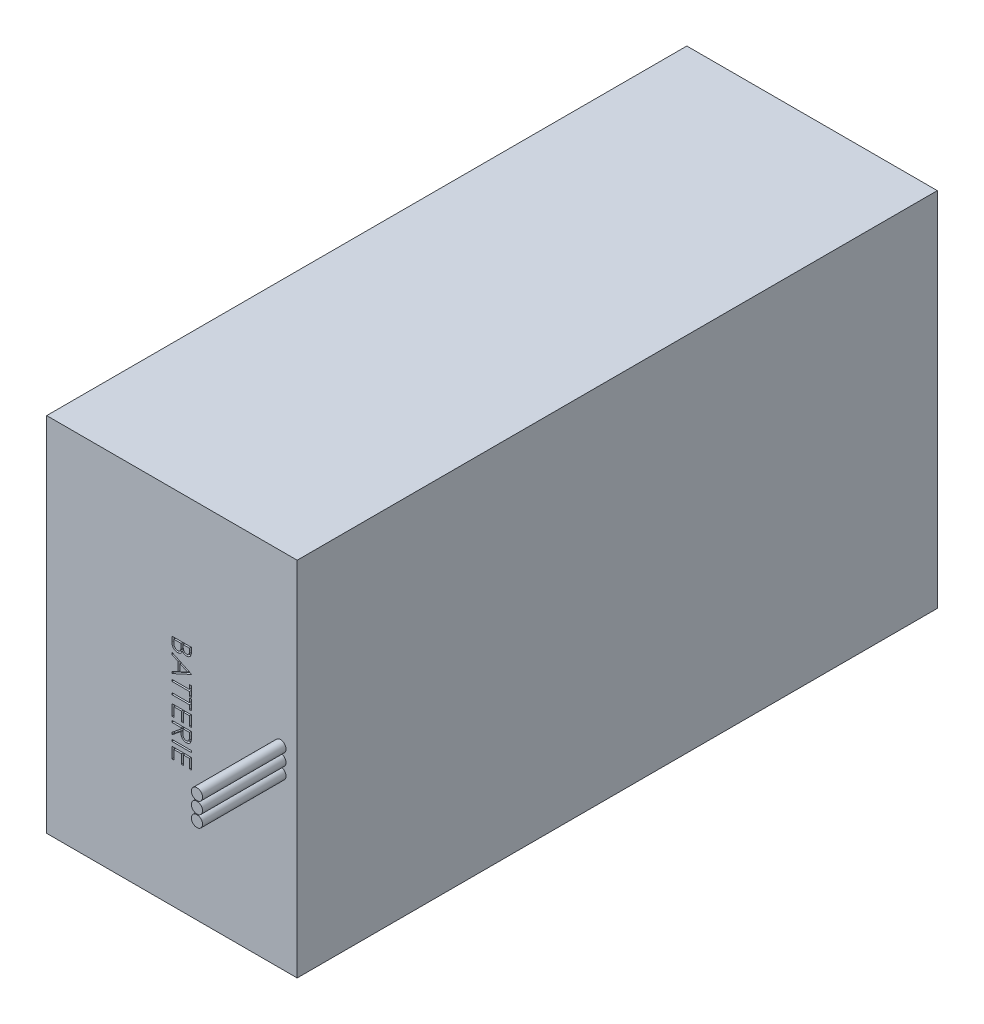
from build123d import *

# Parameters (mm, degrees)
ESQUISSE1_W             = 45
ESQUISSE1_H             = 65
BOSS_EXTRU_1_DEPTH      = 115
ESQUISSE2_R             = 1
BOSS_EXTRU_2_DEPTH      = 15
ESQUISSE4_W             = 3.5
ESQUISSE4_H             = 0.314102564
ENL_V_MAT_EXTRU_2_DEPTH = 0.5


with BuildPart() as part:
    # Esquisse1 → Boss.-Extru.1 (new body)
    with BuildSketch(Plane.XY):
        with Locations((22.5, 32.5)):
            Rectangle(ESQUISSE1_W, ESQUISSE1_H)
    extrude(amount=BOSS_EXTRU_1_DEPTH)

    # Esquisse2 → Boss.-Extru.2 (add)
    with BuildSketch(Plane.XY.offset(115)):
        with Locations(Location((42, 34.6, 0), (0, 0, 180))):
            Circle(ESQUISSE2_R)
        with Locations(Location((42, 32.5, 0), (0, 0, 180))):
            Circle(ESQUISSE2_R)
        with Locations(Location((42, 30.4, 0), (0, 0, 180))):
            Circle(ESQUISSE2_R)
    extrude(amount=BOSS_EXTRU_2_DEPTH)

    # Esquisse4 → Enlèv. mat.-Extru.2 (cut)
    # profile 1 of 8: a face of its own
    with BuildSketch(Plane.XY.offset(115)):
        with BuildLine():
            Line((26, 41.945512821), (26, 41.262620192))
            add(Edge.make_bspline(
                [(26, 41.262620192), (25.99982425, 41.229191714), (25.999483602, 41.164399004), (25.99420047, 41.070179562), (25.986996801, 40.981930751), (25.975566708, 40.899626979), (25.961774931, 40.823306277), (25.945073115, 40.752738639), (25.925046501, 40.688148467), (25.89320022, 40.611035731), (25.845877051, 40.52311507), (25.775948486, 40.427916677), (25.690416023, 40.346512438), (25.593933368, 40.27632612), (25.487797596, 40.220525001), (25.374538407, 40.180155704), (25.255616665, 40.154597828), (25.173973487, 40.151969394), (25.13271234, 40.150641026)],
                knots=[0, 0, 0, 0, 1.001505555, 1.941167018, 2.826882275, 3.653841531, 4.429895133, 5.150066043, 5.825578002, 6.45369114, 7.647487171, 8.808567382, 9.977351308, 11.170798116, 12.373658725, 13.556498008, 14.765093433, 16, 16, 16, 16], degree=3))
            add(Edge.make_bspline(
                [(25.13271234, 40.150641026), (25.094053235, 40.151713115), (25.018084448, 40.153819873), (24.907150679, 40.174651525), (24.801116128, 40.205666884), (24.701287981, 40.250692021), (24.608949247, 40.30860828), (24.52464869, 40.378303814), (24.450429264, 40.461285457), (24.409109541, 40.523557119), (24.388120994, 40.555188301)],
                knots=[0, 0, 0, 0, 1.044266239, 2.052081639, 3.041743201, 4.026043445, 5.00270663, 5.980942822, 6.97441044, 8, 8, 8, 8], degree=3))
            add(Edge.make_bspline(
                [(24.388120994, 40.555188301), (24.372867775, 40.515421215), (24.343684588, 40.439336927), (24.291808319, 40.334559612), (24.236021049, 40.24392491), (24.174776106, 40.167333057), (24.107935032, 40.102816274), (24.036836284, 40.044878864), (23.95797957, 39.996340304), (23.87361028, 39.95464159), (23.784320561, 39.921825139), (23.690518767, 39.898605346), (23.593253774, 39.884337914), (23.526957798, 39.882392407), (23.493489583, 39.881410256)],
                knots=[0, 0, 0, 0, 1.272302504, 2.434229863, 3.488457646, 4.447234501, 5.35599188, 6.26022912, 7.18267843, 8.11661068, 9.06895546, 10.019249207, 11.000057067, 12, 12, 12, 12], degree=3))
            add(Edge.make_bspline(
                [(23.493489583, 39.881410256), (23.459322905, 39.882387409), (23.392099008, 39.884309984), (23.293341106, 39.898485577), (23.198976329, 39.922510777), (23.10833373, 39.955522714), (23.021926377, 39.998852247), (22.938672091, 40.05044643), (22.86078871, 40.113243089), (22.786424081, 40.183238855), (22.719600708, 40.26251659), (22.660109352, 40.34803865), (22.610959363, 40.441035124), (22.570188246, 40.540063883), (22.538590839, 40.645782977), (22.516654453, 40.757800424), (22.501839273, 40.876140566), (22.500623494, 40.957350902), (22.5, 40.998998397)],
                knots=[0, 0, 0, 0, 0.978404568, 1.925038397, 2.85041836, 3.763147166, 4.682162379, 5.614488577, 6.562659439, 7.54271123, 8.535210642, 9.526693784, 10.520907202, 11.541451354, 12.589717429, 13.675358278, 14.807842563, 16, 16, 16, 16], degree=3))
            Line((22.5, 40.998998397), (22.5, 41.945512821))
            Line((22.5, 41.945512821), (26, 41.945512821))
        make_face()
        with BuildLine():
            Line((25.641025641, 41.631410256), (24.519230769, 41.631410256))
            Line((24.519230769, 41.631410256), (24.519230769, 41.420372596))
            add(Edge.make_bspline(
                [(24.519230769, 41.420372596), (24.519627364, 41.389523523), (24.520393667, 41.329916827), (24.522657945, 41.243367536), (24.528720383, 41.163230217), (24.535132411, 41.089228732), (24.545005621, 41.021859071), (24.557087658, 40.960895698), (24.569753809, 40.905790971), (24.591355012, 40.842272003), (24.622955643, 40.770242335), (24.673150423, 40.693944021), (24.731312009, 40.625588757), (24.799660574, 40.568512973), (24.874282065, 40.521415475), (24.955183134, 40.489984648), (25.039205431, 40.467691176), (25.097038901, 40.465736183), (25.126402244, 40.46474359)],
                knots=[0, 0, 0, 0, 1.156481963, 2.23455883, 3.244418989, 4.168404366, 5.01828131, 5.794834307, 6.498111525, 7.13526334, 8.307595709, 9.435046769, 10.546766856, 11.659452936, 12.760769924, 13.837671619, 14.902137667, 16, 16, 16, 16], degree=3))
            add(Edge.make_bspline(
                [(25.126402244, 40.46474359), (25.145837164, 40.465240027), (25.183960884, 40.466213844), (25.239322416, 40.475076735), (25.292056229, 40.487936875), (25.34094948, 40.508028337), (25.387391857, 40.532323067), (25.429320542, 40.563926103), (25.469032638, 40.599616645), (25.505070015, 40.641531714), (25.537359647, 40.689468352), (25.56577169, 40.743883309), (25.588183923, 40.805426328), (25.608288888, 40.872701989), (25.622239543, 40.94678698), (25.633904149, 41.02695739), (25.63983359, 41.113893328), (25.640619428, 41.174038255), (25.641025641, 41.205128205)],
                knots=[0, 0, 0, 0, 0.911752476, 1.788502045, 2.626783689, 3.45400582, 4.26402138, 5.080402872, 5.911472738, 6.767166405, 7.66795952, 8.620018292, 9.640966946, 10.73819047, 11.913090943, 13.176185384, 14.540321519, 16, 16, 16, 16], degree=3))
            Line((25.641025641, 41.205128205), (25.641025641, 41.631410256))
        make_face(mode=Mode.SUBTRACT)
        with BuildLine():
            Line((24.16025641, 41.631410256), (22.858974359, 41.631410256))
            Line((22.858974359, 41.631410256), (22.858974359, 41.184094551))
            add(Edge.make_bspline(
                [(22.858974359, 41.184094551), (22.859356766, 41.152075467), (22.860093805, 41.090362902), (22.862526199, 41.001263785), (22.867942779, 40.918905417), (22.876773248, 40.843240406), (22.885948875, 40.773602695), (22.898648387, 40.710684134), (22.913086196, 40.654388267), (22.93542939, 40.589120076), (22.970080688, 40.51557671), (23.022667742, 40.43637791), (23.084492161, 40.365260638), (23.156948104, 40.30556125), (23.235135085, 40.256263837), (23.31864416, 40.221688685), (23.404927716, 40.199457357), (23.463909533, 40.196830313), (23.493489583, 40.195512821)],
                knots=[0, 0, 0, 0, 1.159821618, 2.235403267, 3.228114831, 4.14795534, 4.994323282, 5.771256229, 6.471395042, 7.097801288, 8.267864287, 9.404187171, 10.531774336, 11.667624178, 12.792825787, 13.866573821, 14.930062559, 16, 16, 16, 16], degree=3))
            add(Edge.make_bspline(
                [(23.493489583, 40.195512821), (23.511985316, 40.195782112), (23.548678445, 40.196316351), (23.602559382, 40.204676292), (23.654984973, 40.216338955), (23.705162465, 40.233227494), (23.753908353, 40.254522573), (23.80037356, 40.281247089), (23.845669087, 40.312108842), (23.902867072, 40.360386822), (23.968791298, 40.430541712), (24.033326389, 40.530254204), (24.085374877, 40.643624887), (24.107474256, 40.72585261), (24.118890224, 40.768329327)],
                knots=[0, 0, 0, 0, 0.723503378, 1.435336582, 2.130201219, 2.824764462, 3.504949994, 4.209866579, 4.920640069, 5.648298893, 7.13757748, 8.670694625, 10.280166878, 12, 12, 12, 12], degree=3))
            add(Edge.make_bspline(
                [(24.118890224, 40.768329327), (24.122345541, 40.785358407), (24.129837379, 40.822280965), (24.137740616, 40.882488851), (24.144830077, 40.951455204), (24.14993647, 41.02888525), (24.155418093, 41.115086938), (24.157474037, 41.210032574), (24.159983424, 41.313789282), (24.160163087, 41.385781743), (24.16025641, 41.423177083)],
                knots=[0, 0, 0, 0, 0.634452549, 1.375623993, 2.216454381, 3.166361212, 4.209414599, 5.370755378, 6.634280627, 8, 8, 8, 8], degree=3))
            Line((24.16025641, 41.423177083), (24.16025641, 41.631410256))
        make_face(mode=Mode.SUBTRACT)
    # profile 2 of 8: a face of its own
    with BuildSketch(Plane.XY.offset(115)):
        Polygon((26, 37.727564103), (22.5, 36.112179487), (22.5, 36.453625801), (23.621794872, 36.971053686), (23.621794872, 38.557692308), (22.5, 39.08984375), (22.5, 39.432692308), (26, 37.772435897), align=None)
        Polygon((25.317808494, 37.753505609), (23.980769231, 38.387319712), (23.980769231, 37.136518429), align=None, mode=Mode.SUBTRACT)
    # profile 3 of 8: a face of its own
    with BuildSketch(Plane.XY.offset(115)):
        Polygon((25.641025641, 35.977564103), (26, 35.977564103), (26, 34.137820513), (25.641025641, 34.137820513), (25.641025641, 34.900641026), (22.5, 34.900641026), (22.5, 35.21474359), (25.641025641, 35.21474359), align=None)
    # profile 4 of 8: a face of its own
    with BuildSketch(Plane.XY.offset(115)):
        Polygon((25.641025641, 33.913461538), (26, 33.913461538), (26, 32.073717949), (25.641025641, 32.073717949), (25.641025641, 32.836538462), (22.5, 32.836538462), (22.5, 33.150641026), (25.641025641, 33.150641026), align=None)
    # profile 5 of 8: a face of its own
    with BuildSketch(Plane.XY.offset(115)):
        Polygon((26, 31.445512821), (26, 29.471153846), (25.641025641, 29.471153846), (25.641025641, 31.131410256), (24.564102564, 31.131410256), (24.564102564, 29.471153846), (24.205128205, 29.471153846), (24.205128205, 31.131410256), (22.858974359, 31.131410256), (22.858974359, 29.471153846), (22.5, 29.471153846), (22.5, 31.445512821), align=None)
    # profile 6 of 8: a face of its own
    with BuildSketch(Plane.XY.offset(115)):
        with BuildLine():
            Line((26, 28.842948718), (26, 28.142528045))
            add(Edge.make_bspline(
                [(26, 28.142528045), (25.999844414, 28.095786916), (25.999545672, 28.006038772), (25.997879909, 27.877465502), (25.993105553, 27.760638405), (25.98899697, 27.655618565), (25.981505028, 27.56240791), (25.974344381, 27.48072062), (25.96497072, 27.410932922), (25.956265297, 27.368687071), (25.952323718, 27.349559295)],
                knots=[0, 0, 0, 0, 1.410062039, 2.707475311, 3.878576406, 4.937260626, 5.877586885, 6.699081471, 7.410979367, 8, 8, 8, 8], degree=3))
            add(Edge.make_bspline(
                [(25.952323718, 27.349559295), (25.94599767, 27.32395222), (25.933480527, 27.273284338), (25.907010513, 27.200340815), (25.876429305, 27.13080235), (25.840231746, 27.064929899), (25.799049203, 27.002717352), (25.752641058, 26.944257858), (25.700770974, 26.889885647), (25.644763494, 26.83918235), (25.584129937, 26.793221444), (25.519753567, 26.753448293), (25.452037023, 26.719390743), (25.38074449, 26.692201577), (25.30647863, 26.670328726), (25.22859096, 26.654901074), (25.147429673, 26.645650277), (25.092071808, 26.644708368), (25.064002404, 26.644230769)],
                knots=[0, 0, 0, 0, 1.02737288, 2.032829108, 3.019628684, 3.985738875, 4.958353778, 5.924249254, 6.890702889, 7.883913451, 8.865824512, 9.85161466, 10.829249435, 11.81541824, 12.821369441, 13.843154991, 14.906364023, 16, 16, 16, 16], degree=3))
            add(Edge.make_bspline(
                [(25.064002404, 26.644230769), (25.017367246, 26.645699729), (24.926369973, 26.648566051), (24.794309841, 26.675291687), (24.671117785, 26.719066259), (24.556965246, 26.779396723), (24.454017226, 26.856189646), (24.363900454, 26.948477279), (24.287792734, 27.055788312), (24.235576131, 27.156156867), (24.20197773, 27.244859251), (24.178219098, 27.318098921), (24.160172121, 27.398051685), (24.143769941, 27.483570499), (24.131253759, 27.57531592), (24.122364892, 27.673103194), (24.116649282, 27.777176892), (24.115814207, 27.848516654), (24.115384615, 27.885216346)],
                knots=[0, 0, 0, 0, 1.260402266, 2.459371274, 3.627181936, 4.786749125, 5.93865593, 7.087644312, 8.261344208, 9.485713728, 10.136162886, 10.825977872, 11.566646758, 12.35154167, 13.181268117, 14.0701832, 15.007234106, 16, 16, 16, 16], degree=3))
            Line((24.115384615, 27.885216346), (22.5, 26.599358974))
            Line((22.5, 26.599358974), (22.5, 26.987780449))
            Line((22.5, 26.987780449), (24.115384615, 28.273637821))
            Line((24.115384615, 28.273637821), (24.115384615, 28.528846154))
            Line((24.115384615, 28.528846154), (22.5, 28.528846154))
            Line((22.5, 28.528846154), (22.5, 28.842948718))
            Line((22.5, 28.842948718), (26, 28.842948718))
        make_face()
        with BuildLine():
            Line((25.641025641, 28.528846154), (24.474358974, 28.528846154))
            Line((24.474358974, 28.528846154), (24.469451122, 27.888020833))
            add(Edge.make_bspline(
                [(24.469451122, 27.888020833), (24.469437885, 27.858100795), (24.469412229, 27.800107238), (24.473406004, 27.716206571), (24.477949327, 27.638086465), (24.484898657, 27.566045694), (24.493854777, 27.500052181), (24.505057604, 27.440138563), (24.51811018, 27.386208179), (24.538309643, 27.323306828), (24.570330282, 27.253089312), (24.616838436, 27.176683269), (24.675714061, 27.111838096), (24.741967426, 27.055928988), (24.816309813, 27.012864735), (24.895441443, 26.981521515), (24.978679147, 26.961851898), (25.03585099, 26.959513458), (25.064703526, 26.958333333)],
                knots=[0, 0, 0, 0, 1.14660753, 2.222451964, 3.218720504, 4.145691244, 4.995719623, 5.770487122, 6.480909919, 7.121111896, 8.299844659, 9.430703709, 10.534634535, 11.641396424, 12.741395289, 13.810956493, 14.895269934, 16, 16, 16, 16], degree=3))
            add(Edge.make_bspline(
                [(25.064703526, 26.958333333), (25.092857905, 26.959517086), (25.148649611, 26.961862851), (25.230103047, 26.981559626), (25.307529909, 27.013367037), (25.379454388, 27.057968389), (25.44528638, 27.111862282), (25.500835297, 27.175869294), (25.547354277, 27.246765953), (25.576864421, 27.313076175), (25.594992971, 27.372304331), (25.607734135, 27.423736438), (25.618056983, 27.482071208), (25.626082803, 27.547168839), (25.633305124, 27.61891156), (25.637987885, 27.697495816), (25.640818147, 27.782830859), (25.640954867, 27.841978041), (25.641025641, 27.872596154)],
                knots=[0, 0, 0, 0, 1.100801541, 2.181386982, 3.260112282, 4.364594493, 5.481957178, 6.577424609, 7.668452592, 8.790448866, 9.403819393, 10.091598921, 10.863153553, 11.720938239, 12.658472417, 13.685008818, 14.801622349, 16, 16, 16, 16], degree=3))
            Line((25.641025641, 27.872596154), (25.641025641, 28.528846154))
        make_face(mode=Mode.SUBTRACT)
    # profile 7 of 8: a face of its own
    with BuildSketch(Plane.XY.offset(115)):
        with Locations((24.25, 25.724358974)):
            Rectangle(ESQUISSE4_W, ESQUISSE4_H)
    # profile 8 of 8: a face of its own
    with BuildSketch(Plane.XY.offset(115)):
        Polygon((26, 24.804487179), (26, 22.830128205), (25.641025641, 22.830128205), (25.641025641, 24.490384615), (24.564102564, 24.490384615), (24.564102564, 22.830128205), (24.205128205, 22.830128205), (24.205128205, 24.490384615), (22.858974359, 24.490384615), (22.858974359, 22.830128205), (22.5, 22.830128205), (22.5, 24.804487179), align=None)
    extrude(amount=-ENL_V_MAT_EXTRU_2_DEPTH, mode=Mode.SUBTRACT)


solid = part.part
